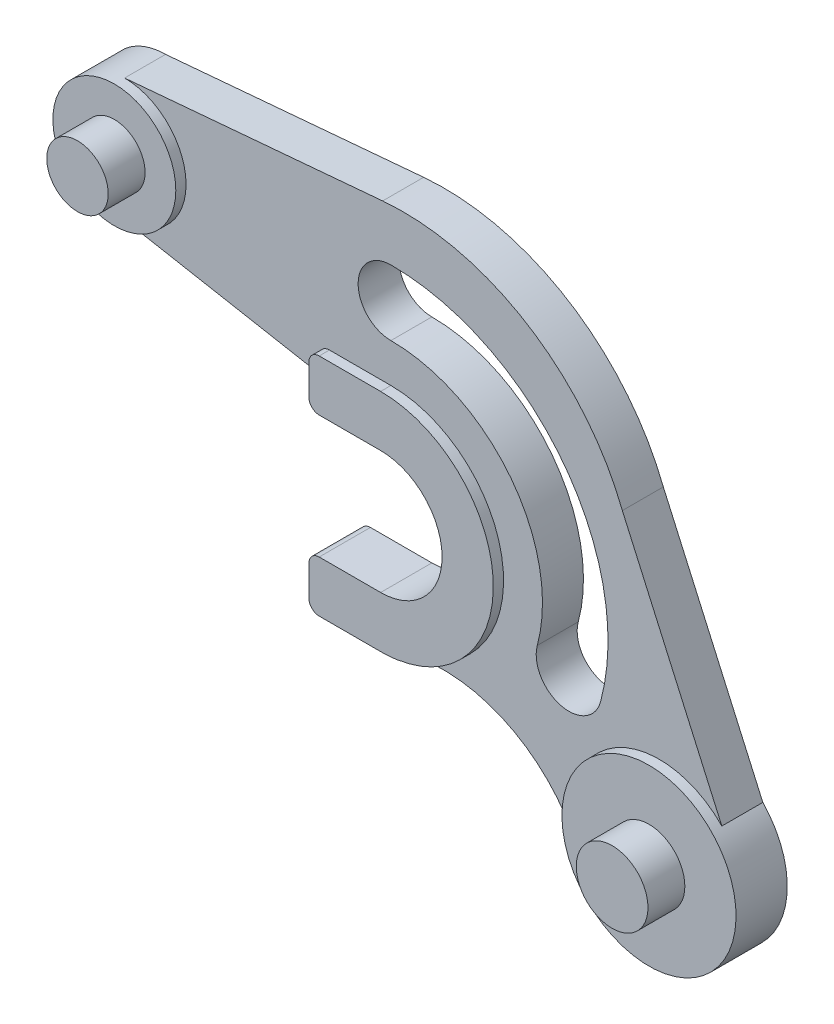
from build123d import *

# Parameters (mm, degrees)
BOSS_EXTRUDE4_DEPTH = 20
SKETCH1_5_R         = 30
SKETCH1_5_R_2       = 15
SKETCH1_5_R_3       = 17.5
BOSS_EXTRUDE5_DEPTH = 25
SKETCH1_6_R         = 15
SKETCH1_6_R_2       = 17.5
BOSS_EXTRUDE6_DEPTH = 43


with BuildPart() as part:
    # Sketch1 → Boss-Extrude4 (new body)
    with BuildSketch(Plane.XY):
        with BuildLine():
            Line((-130, 60), (-35, 42.5))
            Line((-35, 42.5), (-35, 50))
            ThreePointArc((-35, 50), (-33.535533906, 53.535533906), (-30, 55))
            Line((-30, 55), (0, 55))
            ThreePointArc((0, 55), (54.567759373, 6.881833839), (13.655500107, -53.277831382))
            ThreePointArc((13.655500107, -53.277831382), (60.158955917, -61.243831597), (91.746142625, -96.2906317))
            ThreePointArc((91.746142625, -96.2906317), (107.681504867, -44.468355165), (161.565293978, -50.47013708))
            Line((161.565293978, -50.47013708), (112.993286108, 58.624378777))
            ThreePointArc((112.993286108, 58.624378777), (66.508772404, 114.25478106), (-4.020798406, 131.02175198))
            Line((-4.020798406, 131.02175198), (-130, 120))
            ThreePointArc((-130, 120), (-108.786796564, 111.213203436), (-100, 90))
            ThreePointArc((-100, 90), (-108.786796564, 68.786796564), (-130, 60))
        make_face()
        with BuildLine():
            ThreePointArc((0, 106), (84.0970935, 64.526574873), (102.386743403, -27.440021418))
            ThreePointArc((102.386743403, -27.440021418), (82.790250599, -38.752734171), (71.477537847, -19.156241367))
            ThreePointArc((71.477537847, -19.156241367), (58.709291689, 45.046854157), (0, 74))
            ThreePointArc((0, 74), (-16, 90), (0, 106))
        make_face(mode=Mode.SUBTRACT)
    extrude(amount=BOSS_EXTRUDE4_DEPTH)

    # Sketch1<5> → Boss-Extrude5 (add)
    # profile 1 of 3: a face of its own
    with BuildSketch(Plane.XY):
        with BuildLine():
            Line((-35, 50), (-35, 35))
            ThreePointArc((-35, 35), (-33.535533906, 31.464466094), (-30, 30))
            Line((-30, 30), (0, 30))
            ThreePointArc((0, 30), (30, 0), (0, -30))
            Line((0, -30), (-30, -30))
            ThreePointArc((-30, -30), (-33.535533906, -31.464466094), (-35, -35))
            Line((-35, -35), (-35, -50))
            ThreePointArc((-35, -50), (-33.535533906, -53.535533906), (-30, -55))
            Line((-30, -55), (0, -55))
            ThreePointArc((0, -55), (4.190718653, -54.840111936), (8.357072001, -54.361377352))
            ThreePointArc((8.357072001, -54.361377352), (10.996109007, -53.769839654), (13.655500107, -53.277831382))
            ThreePointArc((13.655500107, -53.277831382), (54.567759373, 6.881833839), (0, 55))
            Line((0, 55), (-30, 55))
            ThreePointArc((-30, 55), (-33.535533906, 53.535533906), (-35, 50))
        make_face()
    # profile 2 of 3: a face of its own
    with BuildSketch(Plane.XY):
        with Locations((-130, 90)):
            Circle(SKETCH1_5_R)
        with Locations((-130, 90)):
            Circle(SKETCH1_5_R_2, mode=Mode.SUBTRACT)
    # profile 3 of 3: a face of its own
    with BuildSketch(Plane.XY):
        with BuildLine():
            ThreePointArc((91.877270231, -96.60307247), (170.188604949, -63.553017233), (91.746142625, -96.2906317))
            ThreePointArc((91.746142625, -96.2906317), (91.811890227, -96.446774947), (91.877270231, -96.60307247))
        make_face()
        with Locations((131, -80)):
            Circle(SKETCH1_5_R_3, mode=Mode.SUBTRACT)
    extrude(amount=BOSS_EXTRUDE5_DEPTH)

    # Sketch1<6> → Boss-Extrude6 (add)
    with BuildSketch(Plane.XY):
        with Locations((-130, 90)):
            Circle(SKETCH1_6_R)
        with Locations((131, -80)):
            Circle(SKETCH1_6_R_2)
    extrude(amount=BOSS_EXTRUDE6_DEPTH)


solid = part.part
